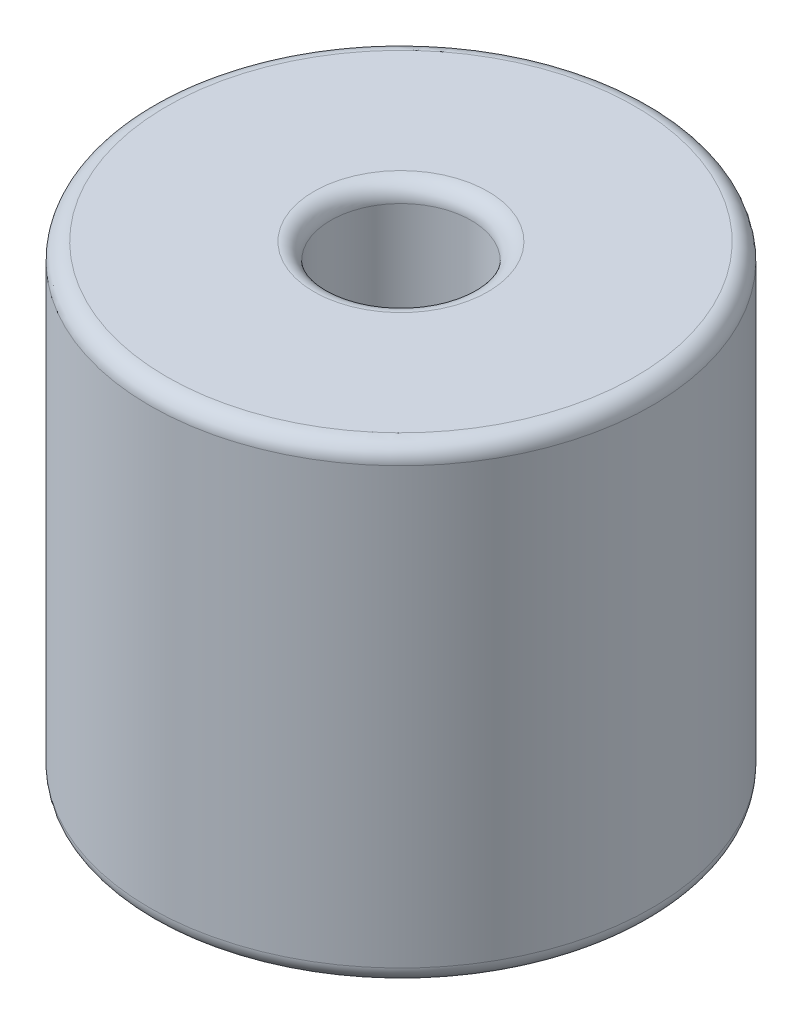
from build123d import *

# Parameters (mm, degrees)
SKETCH1_R           = 7.5
SKETCH1_R_2         = 2.1
BOSS_EXTRUDE1_DEPTH = 14
FILLET1_R           = 0.5


with BuildPart() as part:
    # Sketch1 → Boss-Extrude1 (new body)
    with BuildSketch(Plane(origin=(0, 0, 0), x_dir=(1, 0, 0), z_dir=(0, 1, 0))):
        with Locations(Location((0, 0, 0), (0, 0, 270))):
            Circle(SKETCH1_R)
        with Locations(Location((0, 0, 0), (0, 0, 270))):
            Circle(SKETCH1_R_2, mode=Mode.SUBTRACT)
    extrude(amount=BOSS_EXTRUDE1_DEPTH)

    # Fillet1
    fillet1_edges = [part.edges().sort_by_distance(p)[0] for p in [
        (0, 0, -7.5),
        (0, 14, -7.5),
        (0, 0, -2.1),
        (0, 14, -2.1),
    ]]
    fillet(fillet1_edges, radius=FILLET1_R)


solid = part.part
